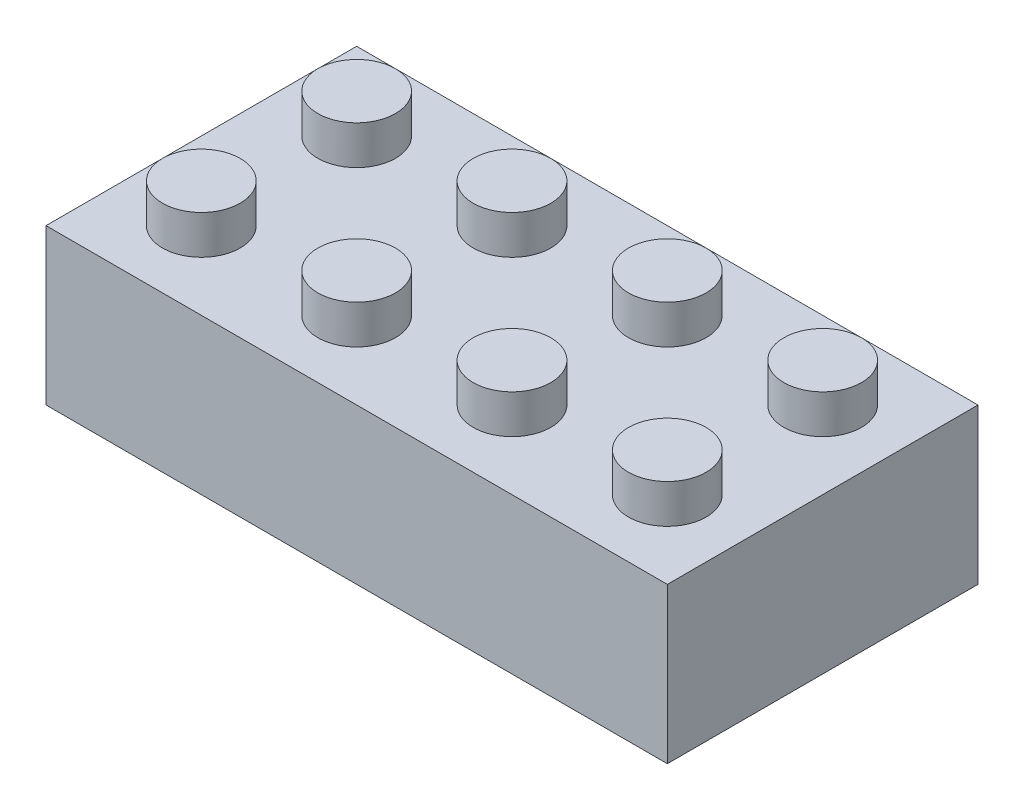
from build123d import *

# Parameters (mm, degrees)
SKETCH1_W            = 20.32
SKETCH1_H            = 10.16
BOSS_EXTRUDE1_DEPTH  = 5.08
SKETCH2_R            = 1.27
BOSS_EXTRUDE2_DEPTH  = 1.27
LPATTERN1_COUNT      = 4
LPATTERN1_PITCH      = 5.08
LPATTERN1_COUNT_DIR2 = 2
LPATTERN1_PITCH_DIR2 = 5.08


with BuildPart() as part:
    # Sketch1 → Boss-Extrude1 (new body)
    with BuildSketch(Plane(origin=(0, 0, 0), x_dir=(1, 0, 0), z_dir=(0, 1, 0))):
        with Locations((10.16, 5.08)):
            Rectangle(SKETCH1_W, SKETCH1_H)
    extrude(amount=BOSS_EXTRUDE1_DEPTH)

    # Sketch2 → Boss-Extrude2 (add)
    with BuildSketch(Plane(origin=(0, 5.08, 0), x_dir=(1, 0, 0), z_dir=(0, 1, 0))):
        with Locations(Location((2.54, 2.54, 0), (0, 0, 90))):
            Circle(SKETCH2_R)
    boss_extrude2 = extrude(amount=BOSS_EXTRUDE2_DEPTH)

    # LPattern1: Boss-Extrude2 4 × 2
    with Locations(*[(i * LPATTERN1_PITCH, 0, -j * LPATTERN1_PITCH_DIR2) for i in range(LPATTERN1_COUNT) for j in range(LPATTERN1_COUNT_DIR2) if (i, j) != (0, 0)]):
        add(boss_extrude2)


solid = part.part
